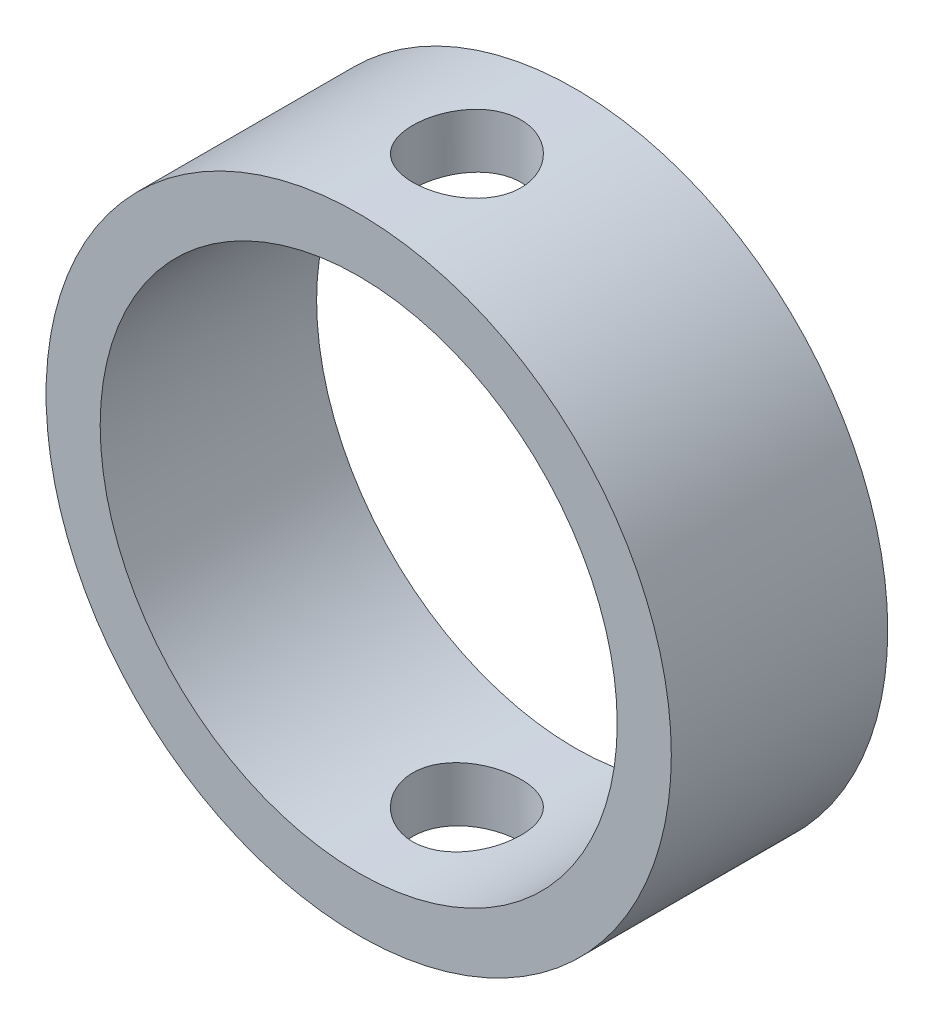
from build123d import *

# Parameters (mm, degrees)
RING_DEPTH            = 12.7
RING_DEPTH_BACK       = 12.7
SKETCH1_R             = 36.688903
SKETCH1_R_2           = 30.338903
SHAFT_HOLE_DEPTH      = 54.417611391
SHAFT_HOLE_DEPTH_BACK = 54.417611391
SKETCH5_R             = 6.35


with BuildPart() as part:
    # Sketch1 → Ring (new, two sides: drawn at the far end of the back side and taken through both)
    with BuildSketch(Plane.XY.offset(-RING_DEPTH_BACK)):
        Circle(SKETCH1_R)
        Circle(SKETCH1_R_2, mode=Mode.SUBTRACT)
    extrude(amount=RING_DEPTH + RING_DEPTH_BACK)

    # Sketch5 → Shaft Hole (cut, two sides: drawn at the far end of the back side and taken through both)
    with BuildSketch(Plane(origin=(0, 0, 0), x_dir=(1, 0, 0), z_dir=(0, 1, 0)).offset(-SHAFT_HOLE_DEPTH_BACK)):
        Circle(SKETCH5_R)
    extrude(amount=SHAFT_HOLE_DEPTH + SHAFT_HOLE_DEPTH_BACK, mode=Mode.SUBTRACT)


solid = part.part
